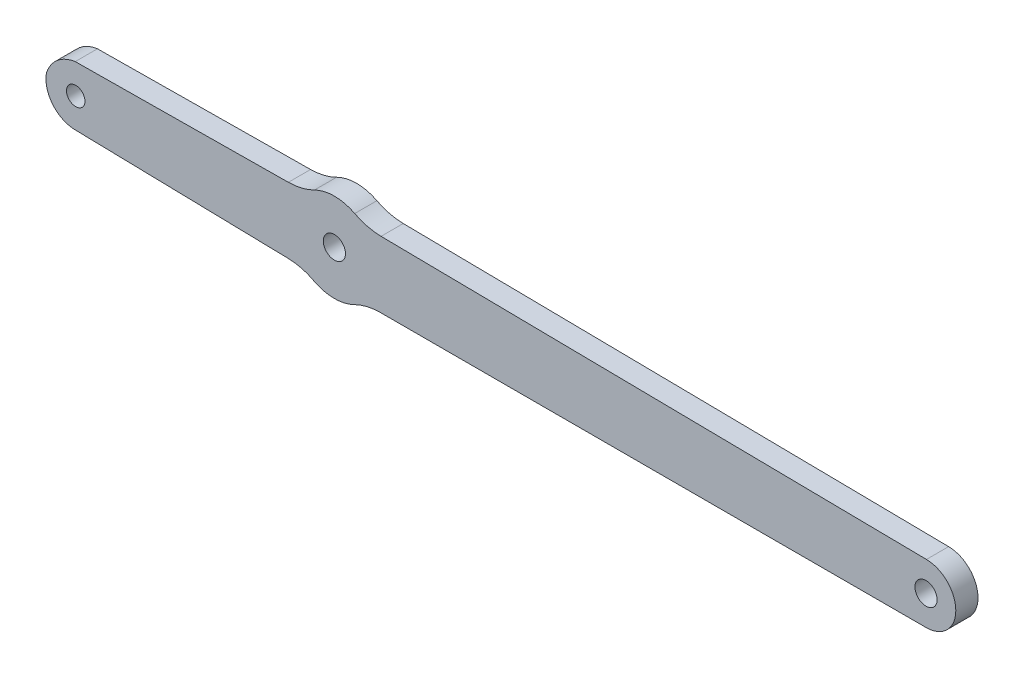
from build123d import *

# Parameters (mm, degrees)
SKETCH_1_R      = 1.5
SKETCH_1_R_2    = 1.25
EXTRUDE_1_DEPTH = 3


with BuildPart() as part:
    # 草圖1 → 填料-伸長1 (new body)
    with BuildSketch(Plane.XY):
        with BuildLine():
            Line((274.299347777, 148.423129747), (281.799361625, 148.423612482))
            ThreePointArc((281.799361625, 148.423612482), (285.772630171, 152.423400918), (281.799039078, 156.422868919))
            Line((281.799039078, 156.422868919), (208.059957025, 157.388166381))
            ThreePointArc((208.059957025, 157.388166381), (206.227394776, 157.625617826), (204.498188507, 158.277164653))
            ThreePointArc((204.498188507, 158.277164653), (201.776837891, 158.94440558), (199.049261052, 158.303091131))
            ThreePointArc((199.049261052, 158.303091131), (197.337154357, 157.674054396), (195.527170706, 157.448320639))
            Line((195.527170706, 157.448320639), (166.71078883, 157.172291775))
            ThreePointArc((166.71078883, 157.172291775), (164.287542162, 156.099039331), (162.814944057, 153.895530755))
            ThreePointArc((162.814944057, 153.895530755), (163.646871886, 150.647297769), (166.658683267, 149.173488539))
            Line((166.658683267, 149.173488539), (195.46902402, 148.522017017))
            ThreePointArc((195.46902402, 148.522017017), (197.279264778, 148.285645759), (198.979735896, 147.621386059))
            ThreePointArc((198.979735896, 147.621386059), (201.698718528, 146.944662918), (204.428513332, 147.576359909))
            ThreePointArc((204.428513332, 147.576359909), (206.166055342, 148.205313289), (208.001547461, 148.418862516))
            Line((208.001547461, 148.418862516), (244.400454544, 148.421205317))
            Line((244.400454544, 148.421205317), (245.400454542, 148.421269682))
            Line((245.400454542, 148.421269682), (273.299347779, 148.423065383))
            Line((273.299347779, 148.423065383), (274.299347777, 148.423129747))
        make_face()
        with Locations((281.746631437, 152.423262482)):
            Circle(SKETCH_1_R, mode=Mode.SUBTRACT)
        with Locations((201.748350524, 152.944502056)):
            Circle(SKETCH_1_R, mode=Mode.SUBTRACT)
        with Locations((166.775315589, 153.179339639)):
            Circle(SKETCH_1_R_2, mode=Mode.SUBTRACT)
    extrude(amount=EXTRUDE_1_DEPTH)


solid = part.part
